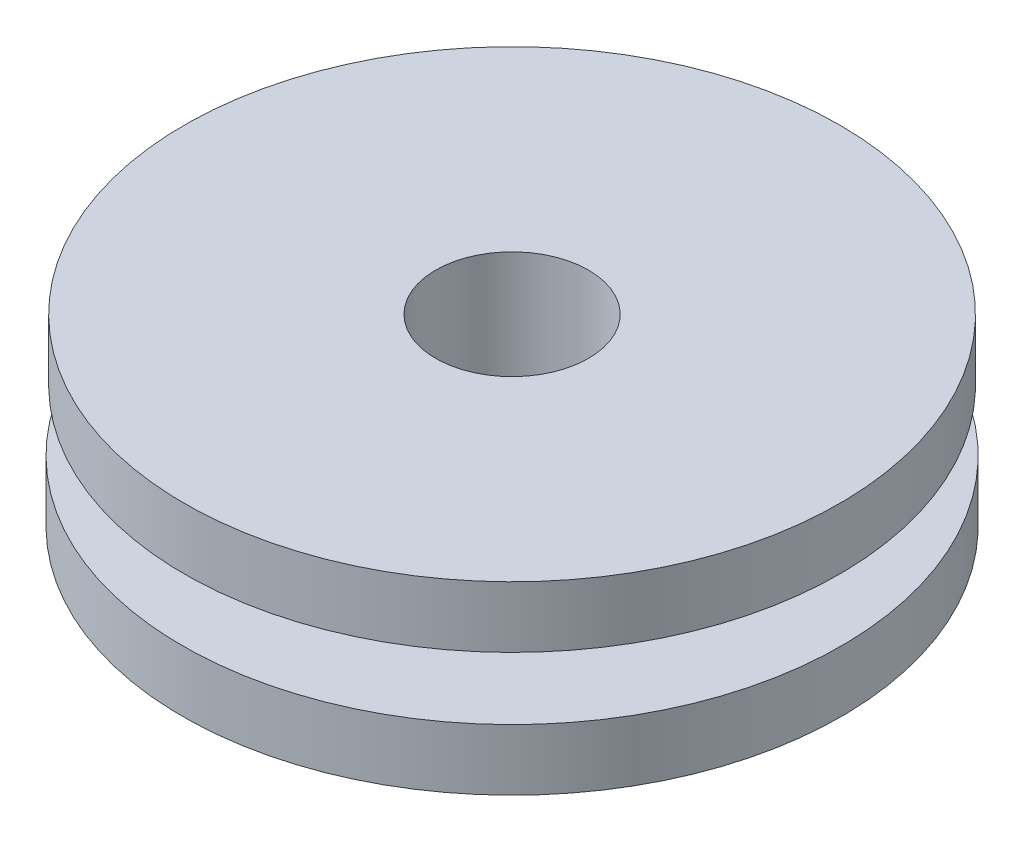
from build123d import *


with BuildPart() as part:
    # Sketch1 → Revolve1 (revolve)
    with BuildSketch(Plane.YZ, mode=Mode.PRIVATE) as revolve1_sk:
        Polygon((-14.999881438, 0.027408751), (-14.999881438, 15.415581909), (-4.999994159, 15.415581909), (-4.999994159, 0.109652172), (5.000005829, 0.109652172), (5.000005829, 15.109652172), (15.000005829, 15.109652172), (15.000005829, 0.109652172), (15.000005829, -25.956139131), (-14.999881438, -25.956139131), align=None)
    revolve(revolve1_sk.sketch.rotate(Axis((0, -15, -38.456139131), (0, 1, 0)), 180), axis=Axis((0, -15, -38.456139131), (0, 1, 0)))


solid = part.part
